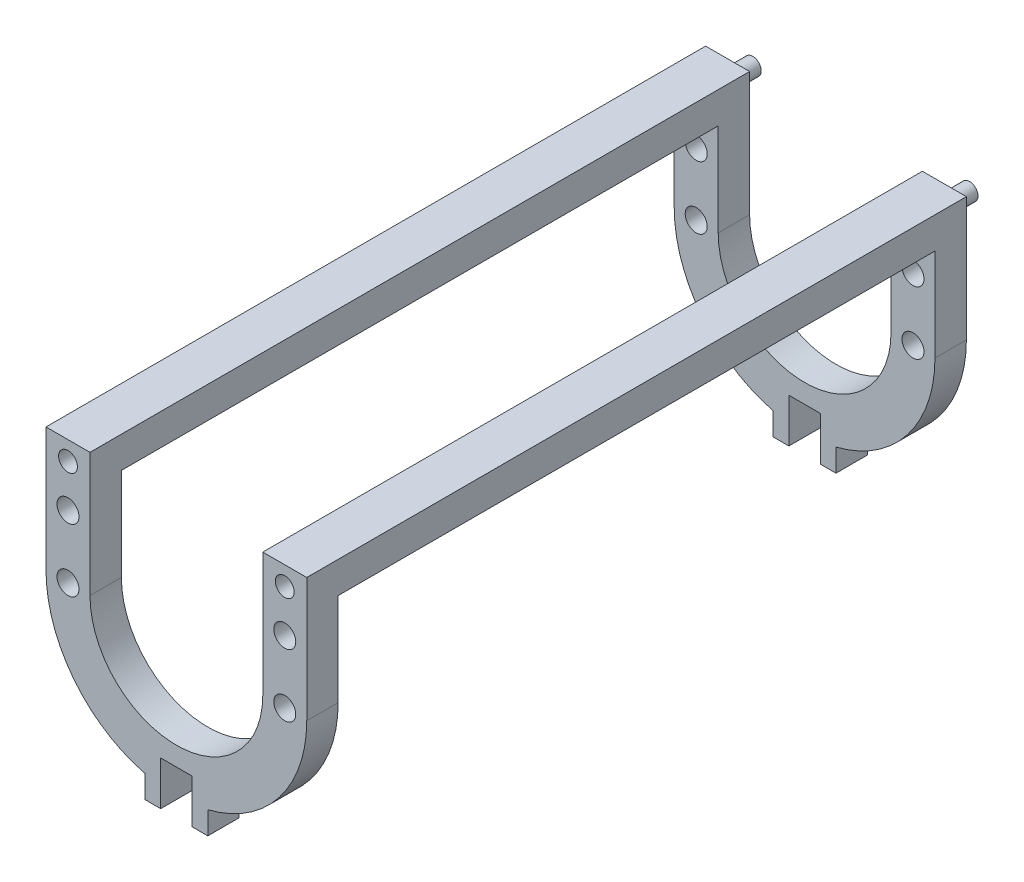
from build123d import *

# Parameters (mm, degrees)
SKETCH1_R           = 1.75
BOSS_EXTRUDE1_DEPTH = 5
SKETCH2_R           = 1.35
BOSS_EXTRUDE2_DEPTH = 4
SKETCH4_W           = 7
SKETCH4_H           = 5
BOSS_EXTRUDE3_DEPTH = 105
BOSS_EXTRUDE4_START = -5
SKETCH5_R           = 1.75
BOSS_EXTRUDE4_DEPTH = 5
SKETCH6_R           = 1.35
CUT_EXTRUDE1_DEPTH  = 5
SKETCH8_R           = 1.5
CUT_EXTRUDE3_DEPTH  = 5


with BuildPart() as part:
    # Sketch1 → Boss-Extrude1 (new body)
    with BuildSketch(Plane.XY):
        with BuildLine():
            Line((-20.753194099, 19.75), (-20.753194099, 0))
            ThreePointArc((-20.753194099, 0), (-16.34718685, -12.785325472), (-5, -20.141873431))
            Line((-5, -20.141873431), (-5, -23.753194099))
            Line((-5, -23.753194099), (-2.5, -23.753194099))
            Line((-2.5, -23.753194099), (-2.5, -16.753194099))
            Line((-2.5, -16.753194099), (2.5, -16.753194099))
            Line((2.5, -16.753194099), (2.5, -23.753194099))
            Line((2.5, -23.753194099), (5, -23.753194099))
            Line((5, -23.753194099), (5, -20.141873431))
            ThreePointArc((5, -20.141873431), (16.34718685, -12.785325472), (20.753194099, 0))
            Line((20.753194099, 0), (20.753194099, 19.75))
            Line((20.753194099, 19.75), (13.753194099, 19.75))
            Line((13.753194099, 19.75), (13.753194099, 0))
            ThreePointArc((13.753194099, 0), (0, -13.753194099), (-13.753194099, 0))
            Line((-13.753194099, 0), (-13.753194099, 19.75))
            Line((-13.753194099, 19.75), (-20.753194099, 19.75))
        make_face()
        with Locations((-17.253194099, 10)):
            Circle(SKETCH1_R, mode=Mode.SUBTRACT)
        with Locations((-17.253194099, 0)):
            Circle(SKETCH1_R, mode=Mode.SUBTRACT)
        with Locations((17.253194099, 0)):
            Circle(SKETCH1_R, mode=Mode.SUBTRACT)
        with Locations((17.253194099, 10)):
            Circle(SKETCH1_R, mode=Mode.SUBTRACT)
    extrude(amount=BOSS_EXTRUDE1_DEPTH)

    # Sketch2 → Boss-Extrude2 (add)
    with BuildSketch(Plane(origin=(0, 0, 0), x_dir=(-1, 0, 0), z_dir=(0, 0, -1))):
        with Locations((17.253194099, 16.75)):
            Circle(SKETCH2_R)
        with Locations(Location((-17.253194099, 16.75, 0), (0, 0, 180))):
            Circle(SKETCH2_R)
    extrude(amount=BOSS_EXTRUDE2_DEPTH)

    # Sketch4 → Boss-Extrude3 (add)
    with BuildSketch(Plane(origin=(0, 0, 0), x_dir=(-1, 0, 0), z_dir=(0, 0, -1))):
        with Locations((17.253194099, 17.25)):
            Rectangle(SKETCH4_W, SKETCH4_H)
        with Locations((-17.253194099, 17.25)):
            Rectangle(SKETCH4_W, SKETCH4_H)
    extrude(amount=-BOSS_EXTRUDE3_DEPTH)

    # Sketch5 → Boss-Extrude4 (add)
    with BuildSketch(Plane.XY.offset(105).offset(BOSS_EXTRUDE4_START)):
        with BuildLine():
            Line((20.753194099, 14.75), (13.753194099, 14.75))
            Line((13.753194099, 14.75), (13.753194099, 0))
            ThreePointArc((13.753194099, 0), (0, -13.753194099), (-13.753194099, 0))
            Line((-13.753194099, 0), (-13.753194099, 14.75))
            Line((-13.753194099, 14.75), (-20.753194099, 14.75))
            Line((-20.753194099, 14.75), (-20.753194099, 0))
            ThreePointArc((-20.753194099, 0), (-16.34718685, -12.785325472), (-5, -20.141873431))
            Line((-5, -20.141873431), (-5, -23.753194099))
            Line((-5, -23.753194099), (-2.5, -23.753194099))
            Line((-2.5, -23.753194099), (-2.5, -16.753194099))
            Line((-2.5, -16.753194099), (2.5, -16.753194099))
            Line((2.5, -16.753194099), (2.5, -23.753194099))
            Line((2.5, -23.753194099), (5, -23.753194099))
            Line((5, -23.753194099), (5, -20.141873431))
            ThreePointArc((5, -20.141873431), (16.34718685, -12.785325472), (20.753194099, 0))
            Line((20.753194099, 0), (20.753194099, 14.75))
        make_face()
        with Locations((17.253194099, 10)):
            Circle(SKETCH5_R, mode=Mode.SUBTRACT)
        with Locations((-17.253194099, 10)):
            Circle(SKETCH5_R, mode=Mode.SUBTRACT)
        with Locations((-17.253194099, 0)):
            Circle(SKETCH5_R, mode=Mode.SUBTRACT)
        with Locations((17.253194099, 0)):
            Circle(SKETCH5_R, mode=Mode.SUBTRACT)
    extrude(amount=BOSS_EXTRUDE4_DEPTH)

    # Sketch6 → Cut-Extrude1 (cut)
    with BuildSketch(Plane.XY.offset(105)):
        with Locations((17.253194099, 16.75)):
            Circle(SKETCH6_R)
        with Locations(Location((-17.253194099, 16.75, 0), (0, 0, 180))):
            Circle(SKETCH6_R)
    extrude(amount=-CUT_EXTRUDE1_DEPTH, mode=Mode.SUBTRACT)

    # Sketch8 → Cut-Extrude3 (cut)
    with BuildSketch(Plane.XY.offset(105)):
        with Locations((17.253194099, 16.75)):
            Circle(SKETCH8_R)
        with Locations((-17.253194099, 16.75)):
            Circle(SKETCH8_R)
    extrude(amount=-CUT_EXTRUDE3_DEPTH, mode=Mode.SUBTRACT)


solid = part.part
